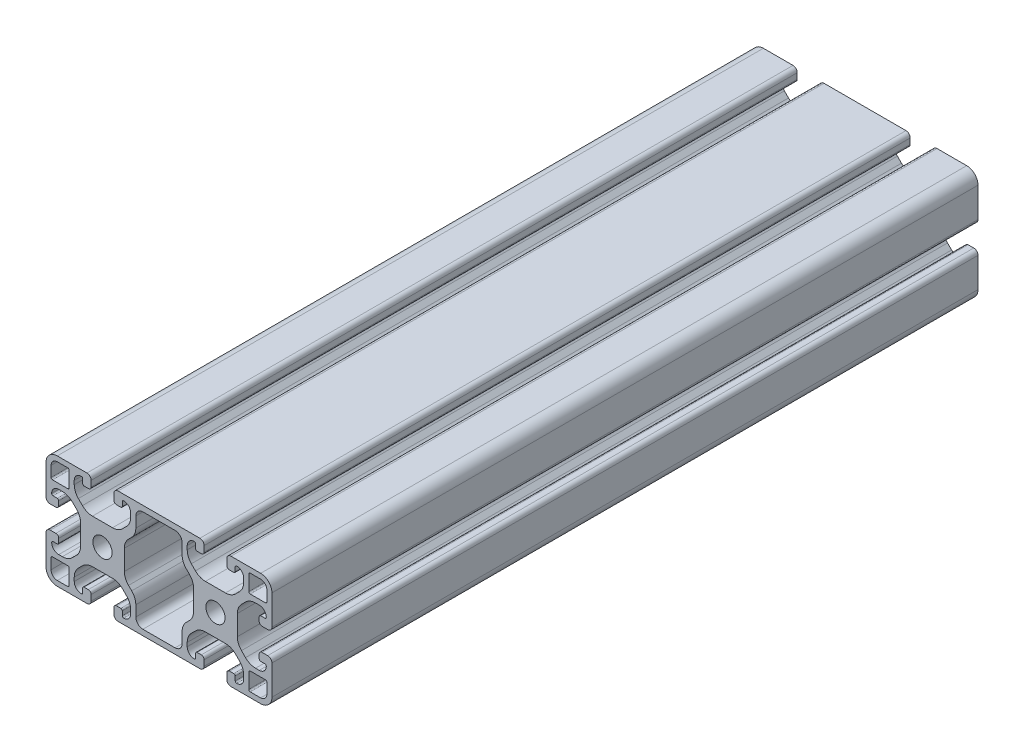
from build123d import *

# Parameters (mm, degrees)
ESQUISSE1_R        = 3.4
BOSS_EXTRU_1_DEPTH = 250


with BuildPart() as part:
    # Esquisse1 → Boss.-Extru.1 (new body)
    with BuildSketch(Plane.XY.offset(20)):
        with BuildLine():
            Line((66.5, 4.5), (65, 4.5))
            ThreePointArc((65, 4.5), (64.292893219, 4.207106781), (64, 3.5))
            Line((64, 3.5), (64, 1.5))
            ThreePointArc((64, 1.5), (64.439339828, 0.439339828), (65.5, 0))
            Line((65.5, 0), (76, 0))
            ThreePointArc((76, 0), (78.828427125, 1.171572875), (80, 4))
            Line((80, 4), (80, 14.5))
            ThreePointArc((80, 14.5), (79.560660172, 15.560660172), (78.5, 16))
            Line((78.5, 16), (76.5, 16))
            ThreePointArc((76.5, 16), (75.792893219, 15.707106781), (75.5, 15))
            Line((75.5, 15), (75.5, 13.5))
            ThreePointArc((75.5, 13.5), (75.646446609, 13.146446609), (76, 13))
            Line((76, 13), (77.5, 13))
            ThreePointArc((77.5, 13), (77.853553391, 12.853553391), (78, 12.5))
            ThreePointArc((78, 12.5), (77.267766953, 10.732233047), (75.5, 10))
            Line((75.5, 10), (74.192388155, 10))
            ThreePointArc((74.192388155, 10), (72.278970994, 10.380602337), (70.656854249, 11.464466094))
            Line((70.656854249, 11.464466094), (69.214466094, 12.906854249))
            ThreePointArc((69.214466094, 12.906854249), (68.130602337, 14.528970994), (67.75, 16.442388155))
            Line((67.75, 16.442388155), (67.75, 23.557611845))
            ThreePointArc((67.75, 23.557611845), (68.130602337, 25.471029006), (69.214466094, 27.093145751))
            Line((69.214466094, 27.093145751), (70.656854249, 28.535533906))
            ThreePointArc((70.656854249, 28.535533906), (72.278970994, 29.619397663), (74.192388155, 30))
            Line((74.192388155, 30), (75.5, 30))
            ThreePointArc((75.5, 30), (77.267766953, 29.267766953), (78, 27.5))
            ThreePointArc((78, 27.5), (77.853553391, 27.146446609), (77.5, 27))
            Line((77.5, 27), (76, 27))
            ThreePointArc((76, 27), (75.646446609, 26.853553391), (75.5, 26.5))
            Line((75.5, 26.5), (75.5, 25))
            ThreePointArc((75.5, 25), (75.792893219, 24.292893219), (76.5, 24))
            Line((76.5, 24), (78.5, 24))
            ThreePointArc((78.5, 24), (79.560660172, 24.439339828), (80, 25.5))
            Line((80, 25.5), (80, 36))
            ThreePointArc((80, 36), (78.828427125, 38.828427125), (76, 40))
            Line((76, 40), (65.5, 40))
            ThreePointArc((65.5, 40), (64.439339828, 39.560660172), (64, 38.5))
            Line((64, 38.5), (64, 36.5))
            ThreePointArc((64, 36.5), (64.292893219, 35.792893219), (65, 35.5))
            Line((65, 35.5), (66.5, 35.5))
            ThreePointArc((66.5, 35.5), (66.853553391, 35.646446609), (67, 36))
            Line((67, 36), (67, 37.5))
            ThreePointArc((67, 37.5), (67.146446609, 37.853553391), (67.5, 38))
            ThreePointArc((67.5, 38), (69.267766953, 37.267766953), (70, 35.5))
            Line((70, 35.5), (70, 34.192388155))
            ThreePointArc((70, 34.192388155), (69.619397663, 32.278970994), (68.535533906, 30.656854249))
            Line((68.535533906, 30.656854249), (67.093145751, 29.214466094))
            ThreePointArc((67.093145751, 29.214466094), (65.471029006, 28.130602337), (63.557611845, 27.75))
            Line((63.557611845, 27.75), (56.442388155, 27.75))
            ThreePointArc((56.442388155, 27.75), (54.528970994, 28.130602337), (52.906854249, 29.214466094))
            Line((52.906854249, 29.214466094), (51.464466094, 30.656854249))
            ThreePointArc((51.464466094, 30.656854249), (50.380602337, 32.278970994), (50, 34.192388155))
            Line((50, 34.192388155), (50, 35.5))
            ThreePointArc((50, 35.5), (50.732233047, 37.267766953), (52.5, 38))
            ThreePointArc((52.5, 38), (52.853553391, 37.853553391), (53, 37.5))
            Line((53, 37.5), (53, 36))
            ThreePointArc((53, 36), (53.146446609, 35.646446609), (53.5, 35.5))
            Line((53.5, 35.5), (55, 35.5))
            ThreePointArc((55, 35.5), (55.707106781, 35.792893219), (56, 36.5))
            Line((56, 36.5), (56, 38.5))
            ThreePointArc((56, 38.5), (55.560660172, 39.560660172), (54.5, 40))
            Line((54.5, 40), (25.5, 40))
            ThreePointArc((25.5, 40), (24.439339828, 39.560660172), (24, 38.5))
            Line((24, 38.5), (24, 36.5))
            ThreePointArc((24, 36.5), (24.292893219, 35.792893219), (25, 35.5))
            Line((25, 35.5), (26.5, 35.5))
            ThreePointArc((26.5, 35.5), (26.853553391, 35.646446609), (27, 36))
            Line((27, 36), (27, 37.5))
            ThreePointArc((27, 37.5), (27.146446609, 37.853553391), (27.5, 38))
            ThreePointArc((27.5, 38), (29.267766953, 37.267766953), (30, 35.5))
            Line((30, 35.5), (30, 34.192388155))
            ThreePointArc((30, 34.192388155), (29.619397663, 32.278970994), (28.535533906, 30.656854249))
            Line((28.535533906, 30.656854249), (27.093145751, 29.214466094))
            ThreePointArc((27.093145751, 29.214466094), (25.471029006, 28.130602337), (23.557611845, 27.75))
            Line((23.557611845, 27.75), (16.442388155, 27.75))
            ThreePointArc((16.442388155, 27.75), (14.528970994, 28.130602337), (12.906854249, 29.214466094))
            Line((12.906854249, 29.214466094), (11.464466094, 30.656854249))
            ThreePointArc((11.464466094, 30.656854249), (10.380602337, 32.278970994), (10, 34.192388155))
            Line((10, 34.192388155), (10, 35.5))
            ThreePointArc((10, 35.5), (10.732233047, 37.267766953), (12.5, 38))
            ThreePointArc((12.5, 38), (12.853553391, 37.853553391), (13, 37.5))
            Line((13, 37.5), (13, 36))
            ThreePointArc((13, 36), (13.146446609, 35.646446609), (13.5, 35.5))
            Line((13.5, 35.5), (15, 35.5))
            ThreePointArc((15, 35.5), (15.707106781, 35.792893219), (16, 36.5))
            Line((16, 36.5), (16, 38.5))
            ThreePointArc((16, 38.5), (15.560660172, 39.560660172), (14.5, 40))
            Line((14.5, 40), (4, 40))
            ThreePointArc((4, 40), (1.171572875, 38.828427125), (0, 36))
            Line((0, 36), (0, 25.5))
            ThreePointArc((0, 25.5), (0.439339828, 24.439339828), (1.5, 24))
            Line((1.5, 24), (3.5, 24))
            ThreePointArc((3.5, 24), (4.207106781, 24.292893219), (4.5, 25))
            Line((4.5, 25), (4.5, 26.5))
            ThreePointArc((4.5, 26.5), (4.353553391, 26.853553391), (4, 27))
            Line((4, 27), (2.5, 27))
            ThreePointArc((2.5, 27), (2.146446609, 27.146446609), (2, 27.5))
            ThreePointArc((2, 27.5), (2.732233047, 29.267766953), (4.5, 30))
            Line((4.5, 30), (5.807611845, 30))
            ThreePointArc((5.807611845, 30), (7.721029006, 29.619397663), (9.343145751, 28.535533906))
            Line((9.343145751, 28.535533906), (10.785533906, 27.093145751))
            ThreePointArc((10.785533906, 27.093145751), (11.869397663, 25.471029006), (12.25, 23.557611845))
            Line((12.25, 23.557611845), (12.25, 16.442388155))
            ThreePointArc((12.25, 16.442388155), (11.869397663, 14.528970994), (10.785533906, 12.906854249))
            Line((10.785533906, 12.906854249), (9.343145751, 11.464466094))
            ThreePointArc((9.343145751, 11.464466094), (7.721029006, 10.380602337), (5.807611845, 10))
            Line((5.807611845, 10), (4.5, 10))
            ThreePointArc((4.5, 10), (2.732233047, 10.732233047), (2, 12.5))
            ThreePointArc((2, 12.5), (2.146446609, 12.853553391), (2.5, 13))
            Line((2.5, 13), (4, 13))
            ThreePointArc((4, 13), (4.353553391, 13.146446609), (4.5, 13.5))
            Line((4.5, 13.5), (4.5, 15))
            ThreePointArc((4.5, 15), (4.207106781, 15.707106781), (3.5, 16))
            Line((3.5, 16), (1.5, 16))
            ThreePointArc((1.5, 16), (0.439339828, 15.560660172), (0, 14.5))
            Line((0, 14.5), (0, 4))
            ThreePointArc((0, 4), (1.171572875, 1.171572875), (4, 0))
            Line((4, 0), (14.5, 0))
            ThreePointArc((14.5, 0), (15.560660172, 0.439339828), (16, 1.5))
            Line((16, 1.5), (16, 3.5))
            ThreePointArc((16, 3.5), (15.707106781, 4.207106781), (15, 4.5))
            Line((15, 4.5), (13.5, 4.5))
            ThreePointArc((13.5, 4.5), (13.146446609, 4.353553391), (13, 4))
            Line((13, 4), (13, 2.5))
            ThreePointArc((13, 2.5), (12.853553391, 2.146446609), (12.5, 2))
            ThreePointArc((12.5, 2), (10.732233047, 2.732233047), (10, 4.5))
            Line((10, 4.5), (10, 5.807611845))
            ThreePointArc((10, 5.807611845), (10.380602337, 7.721029006), (11.464466094, 9.343145751))
            Line((11.464466094, 9.343145751), (12.906854249, 10.785533906))
            ThreePointArc((12.906854249, 10.785533906), (14.528970994, 11.869397663), (16.442388155, 12.25))
            Line((16.442388155, 12.25), (23.557611845, 12.25))
            ThreePointArc((23.557611845, 12.25), (25.471029006, 11.869397663), (27.093145751, 10.785533906))
            Line((27.093145751, 10.785533906), (28.535533906, 9.343145751))
            ThreePointArc((28.535533906, 9.343145751), (29.619397663, 7.721029006), (30, 5.807611845))
            Line((30, 5.807611845), (30, 4.5))
            ThreePointArc((30, 4.5), (29.267766953, 2.732233047), (27.5, 2))
            ThreePointArc((27.5, 2), (27.146446609, 2.146446609), (27, 2.5))
            Line((27, 2.5), (27, 4))
            ThreePointArc((27, 4), (26.853553391, 4.353553391), (26.5, 4.5))
            Line((26.5, 4.5), (25, 4.5))
            ThreePointArc((25, 4.5), (24.292893219, 4.207106781), (24, 3.5))
            Line((24, 3.5), (24, 1.5))
            ThreePointArc((24, 1.5), (24.439339828, 0.439339828), (25.5, 0))
            Line((25.5, 0), (54.5, 0))
            ThreePointArc((54.5, 0), (55.560660172, 0.439339828), (56, 1.5))
            Line((56, 1.5), (56, 3.5))
            ThreePointArc((56, 3.5), (55.707106781, 4.207106781), (55, 4.5))
            Line((55, 4.5), (53.5, 4.5))
            ThreePointArc((53.5, 4.5), (53.146446609, 4.353553391), (53, 4))
            Line((53, 4), (53, 2.5))
            ThreePointArc((53, 2.5), (52.853553391, 2.146446609), (52.5, 2))
            ThreePointArc((52.5, 2), (50.732233047, 2.732233047), (50, 4.5))
            Line((50, 4.5), (50, 5.807611845))
            ThreePointArc((50, 5.807611845), (50.380602337, 7.721029006), (51.464466094, 9.343145751))
            Line((51.464466094, 9.343145751), (52.906854249, 10.785533906))
            ThreePointArc((52.906854249, 10.785533906), (54.528970994, 11.869397663), (56.442388155, 12.25))
            Line((56.442388155, 12.25), (63.557611845, 12.25))
            ThreePointArc((63.557611845, 12.25), (65.471029006, 11.869397663), (67.093145751, 10.785533906))
            Line((67.093145751, 10.785533906), (68.535533906, 9.343145751))
            ThreePointArc((68.535533906, 9.343145751), (69.619397663, 7.721029006), (70, 5.807611845))
            Line((70, 5.807611845), (70, 4.5))
            ThreePointArc((70, 4.5), (69.267766953, 2.732233047), (67.5, 2))
            ThreePointArc((67.5, 2), (67.146446609, 2.146446609), (67, 2.5))
            Line((67, 2.5), (67, 4))
            ThreePointArc((67, 4), (66.853553391, 4.353553391), (66.5, 4.5))
        make_face()
        with Locations(Location((20, 20, 0), (0, 0, 180))):
            Circle(ESQUISSE1_R, mode=Mode.SUBTRACT)
        with Locations(Location((60, 20, 0), (0, 0, 180))):
            Circle(ESQUISSE1_R, mode=Mode.SUBTRACT)
        with BuildLine():
            Line((31.8, 4.5), (31.8, 8.250252532))
            ThreePointArc((31.8, 8.250252532), (31.419397663, 10.163669694), (30.335533906, 11.785786438))
            Line((30.335533906, 11.785786438), (29.214466094, 12.906854249))
            ThreePointArc((29.214466094, 12.906854249), (28.130602337, 14.528970994), (27.75, 16.442388155))
            Line((27.75, 16.442388155), (27.75, 23.557611845))
            ThreePointArc((27.75, 23.557611845), (28.130602337, 25.471029006), (29.214466094, 27.093145751))
            Line((29.214466094, 27.093145751), (30.335533906, 28.214213562))
            ThreePointArc((30.335533906, 28.214213562), (31.419397663, 29.836330306), (31.8, 31.749747468))
            Line((31.8, 31.749747468), (31.8, 35.5))
            ThreePointArc((31.8, 35.5), (32.532233047, 37.267766953), (34.3, 38))
            Line((34.3, 38), (45.7, 38))
            ThreePointArc((45.7, 38), (47.467766953, 37.267766953), (48.2, 35.5))
            Line((48.2, 35.5), (48.2, 31.749747468))
            ThreePointArc((48.2, 31.749747468), (48.580602337, 29.836330306), (49.664466094, 28.214213562))
            Line((49.664466094, 28.214213562), (50.785533906, 27.093145751))
            ThreePointArc((50.785533906, 27.093145751), (51.869397663, 25.471029006), (52.25, 23.557611845))
            Line((52.25, 23.557611845), (52.25, 16.442388155))
            ThreePointArc((52.25, 16.442388155), (51.869397663, 14.528970994), (50.785533906, 12.906854249))
            Line((50.785533906, 12.906854249), (49.664466094, 11.785786438))
            ThreePointArc((49.664466094, 11.785786438), (48.580602337, 10.163669694), (48.2, 8.250252532))
            Line((48.2, 8.250252532), (48.2, 4.5))
            ThreePointArc((48.2, 4.5), (47.467766953, 2.732233047), (45.7, 2))
            Line((45.7, 2), (34.3, 2))
            ThreePointArc((34.3, 2), (32.532233047, 2.732233047), (31.8, 4.5))
        make_face(mode=Mode.SUBTRACT)
        with BuildLine():
            Line((7.7, 1.8), (4, 1.8))
            ThreePointArc((4, 1.8), (2.444365081, 2.444365081), (1.8, 4))
            Line((1.8, 4), (1.8, 7.7))
            ThreePointArc((1.8, 7.7), (1.946446609, 8.053553391), (2.3, 8.2))
            Line((2.3, 8.2), (7.7, 8.2))
            ThreePointArc((7.7, 8.2), (8.053553391, 8.053553391), (8.2, 7.7))
            Line((8.2, 7.7), (8.2, 2.3))
            ThreePointArc((8.2, 2.3), (8.053553391, 1.946446609), (7.7, 1.8))
        make_face(mode=Mode.SUBTRACT)
        with BuildLine():
            Line((72.3, 38.2), (76, 38.2))
            ThreePointArc((76, 38.2), (77.555634919, 37.555634919), (78.2, 36))
            Line((78.2, 36), (78.2, 32.3))
            ThreePointArc((78.2, 32.3), (78.053553391, 31.946446609), (77.7, 31.8))
            Line((77.7, 31.8), (72.3, 31.8))
            ThreePointArc((72.3, 31.8), (71.946446609, 31.946446609), (71.8, 32.3))
            Line((71.8, 32.3), (71.8, 37.7))
            ThreePointArc((71.8, 37.7), (71.946446609, 38.053553391), (72.3, 38.2))
        make_face(mode=Mode.SUBTRACT)
        with BuildLine():
            Line((78.2, 7.7), (78.2, 4))
            ThreePointArc((78.2, 4), (77.555634919, 2.444365081), (76, 1.8))
            Line((76, 1.8), (72.3, 1.8))
            ThreePointArc((72.3, 1.8), (71.946446609, 1.946446609), (71.8, 2.3))
            Line((71.8, 2.3), (71.8, 7.7))
            ThreePointArc((71.8, 7.7), (71.946446609, 8.053553391), (72.3, 8.2))
            Line((72.3, 8.2), (77.7, 8.2))
            ThreePointArc((77.7, 8.2), (78.053553391, 8.053553391), (78.2, 7.7))
        make_face(mode=Mode.SUBTRACT)
        with BuildLine():
            Line((1.8, 32.3), (1.8, 36))
            ThreePointArc((1.8, 36), (2.444365081, 37.555634919), (4, 38.2))
            Line((4, 38.2), (7.7, 38.2))
            ThreePointArc((7.7, 38.2), (8.053553391, 38.053553391), (8.2, 37.7))
            Line((8.2, 37.7), (8.2, 32.3))
            ThreePointArc((8.2, 32.3), (8.053553391, 31.946446609), (7.7, 31.8))
            Line((7.7, 31.8), (2.3, 31.8))
            ThreePointArc((2.3, 31.8), (1.946446609, 31.946446609), (1.8, 32.3))
        make_face(mode=Mode.SUBTRACT)
    extrude(amount=-BOSS_EXTRU_1_DEPTH)


solid = part.part
